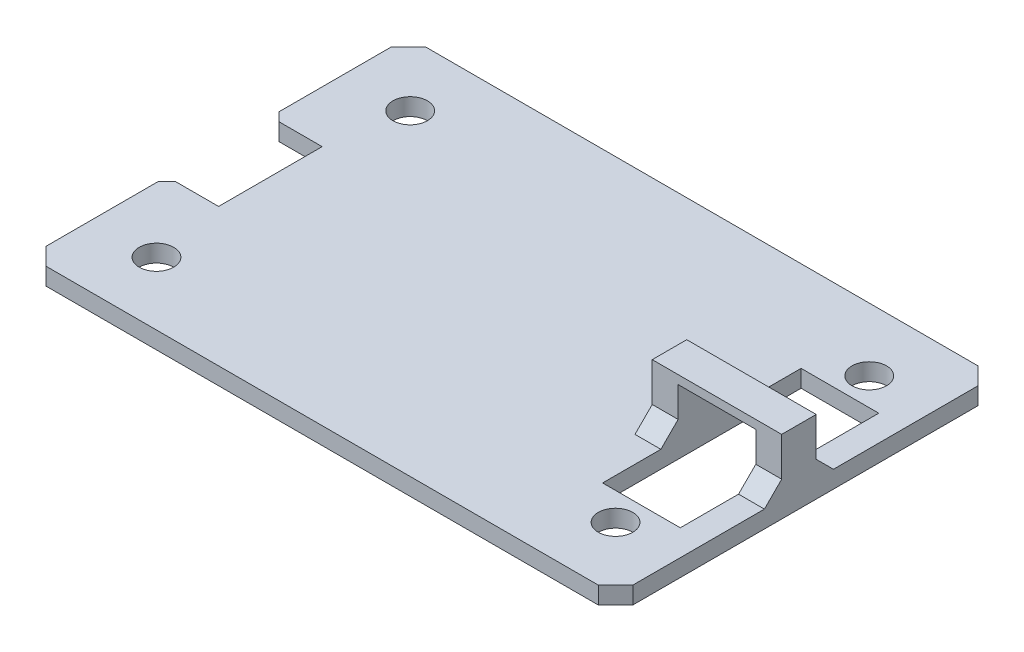
from build123d import *

# Parameters (mm, degrees)
SKETCH1_W               = 68
SKETCH1_H               = 44
BOSS_EXTRUDE1_DEPTH     = 2
SKETCH2_R               = 2
CUT_EXTRUDE1_DEPTH      = 2
SKETCH3_W               = 12
SKETCH3_H               = 23
CUT_EXTRUDE2_DEPTH      = 2
SKETCH4_W               = 3
SKETCH4_H               = 23
BOSS_EXTRUDE2_DEPTH     = 2
SKETCH5_W               = 3
SKETCH5_H               = 21.5
BOSS_EXTRUDE3_DEPTH     = 6.5
SKETCH6_W               = 4
SKETCH6_H               = 2
BOSS_EXTRUDE4_DEPTH     = 10
CUT_EXTRUDE3_DEPTH      = 20
CUT_EXTRUDE3_DEPTH_BACK = 20
SKETCH7_W               = 8.75
SKETCH7_H               = 6.5
SKETCH7_W_2             = 10.25
CHAMFER1_SIZE           = 2
SKETCH8_W               = 6
SKETCH8_H               = 12
CUT_EXTRUDE4_DEPTH      = 20
CHAMFER2_SIZE           = 1
CHAMFER3_SIZE           = 1
CHAMFER4_SIZE           = 2


with BuildPart() as part:
    # Sketch1 → Boss-Extrude1 (new body)
    with BuildSketch(Plane(origin=(0, 0, 0), x_dir=(1, 0, 0), z_dir=(0, 1, 0))):
        with Locations((4.391941392, -7.446886447)):
            Rectangle(SKETCH1_W, SKETCH1_H)
    extrude(amount=BOSS_EXTRUDE1_DEPTH)

    # Sketch2 → Cut-Extrude1 (cut)
    with BuildSketch(Plane(origin=(0, 2, 0), x_dir=(1, 0, 0), z_dir=(0, 1, 0))):
        with Locations(Location((-22.108058608, 7.253113553, 0), (0, 0, 270))):
            Circle(SKETCH2_R)
        with Locations(Location((31.091941392, 7.253113553, 0), (0, 0, 270))):
            Circle(SKETCH2_R)
        with Locations(Location((31.091941392, -22.146886447, 0), (0, 0, 270))):
            Circle(SKETCH2_R)
        with Locations(Location((-22.108058608, -22.146886447, 0), (0, 0, 270))):
            Circle(SKETCH2_R)
    extrude(amount=-CUT_EXTRUDE1_DEPTH, mode=Mode.SUBTRACT)

    # Sketch3 → Cut-Extrude2 (cut)
    with BuildSketch(Plane(origin=(0, 2, 0), x_dir=(1, 0, 0), z_dir=(0, 1, 0))):
        with Locations((32.391941392, -7.446886447)):
            Rectangle(SKETCH3_W, SKETCH3_H)
    extrude(amount=-CUT_EXTRUDE2_DEPTH, mode=Mode.SUBTRACT)

    # Sketch4 → Boss-Extrude2 (add)
    with BuildSketch(Plane(origin=(0, 2, 0), x_dir=(1, 0, 0), z_dir=(0, 1, 0))):
        with Locations((36.891941392, -7.446886447)):
            Rectangle(SKETCH4_W, SKETCH4_H)
    extrude(amount=-BOSS_EXTRUDE2_DEPTH)

    # Sketch5 → Boss-Extrude3 (add)
    with BuildSketch(Plane(origin=(0, 2, 0), x_dir=(1, 0, 0), z_dir=(0, 1, 0))):
        with Locations((36.891941392, -6.696886447)):
            Rectangle(SKETCH5_W, SKETCH5_H)
        with Locations((24.891941392, -8.196886447)):
            Rectangle(SKETCH5_W, SKETCH5_H)
    extrude(amount=BOSS_EXTRUDE3_DEPTH)

    # Sketch6 → Boss-Extrude4 (add)
    with BuildSketch(Plane(origin=(26.391941392, 0, 0), x_dir=(0, 0, -1), z_dir=(1, 0, 0))):
        with Locations((-8.196886447, 7.5)):
            Rectangle(SKETCH6_W, SKETCH6_H)
    extrude(amount=BOSS_EXTRUDE4_DEPTH)

    # Sketch7 → Cut-Extrude3 (cut, two sides: drawn at the far end of the back side and taken through both)
    with BuildSketch(Plane(origin=(26.391941392, 0, 0), x_dir=(0, 0, -1), z_dir=(1, 0, 0)).offset(-CUT_EXTRUDE3_DEPTH_BACK)):
        with Locations((-14.571886447, 5.25)):
            Rectangle(SKETCH7_W, SKETCH7_H)
        with Locations((-1.071886447, 5.25)):
            Rectangle(SKETCH7_W_2, SKETCH7_H)
    extrude(amount=CUT_EXTRUDE3_DEPTH + CUT_EXTRUDE3_DEPTH_BACK, mode=Mode.SUBTRACT)

    # Chamfer1
    chamfer1_edges = [part.edges().sort_by_distance(p)[0] for p in [
        (24.891941392, 2, 10.196886447),
        (36.891941392, 2, 10.196886447),
        (24.891941392, 2, 6.196886447),
        (36.891941392, 2, 6.196886447),
    ]]
    chamfer(chamfer1_edges, length=CHAMFER1_SIZE)

    # Sketch8 → Cut-Extrude4 (cut)
    with BuildSketch(Plane(origin=(0, 2, 0), x_dir=(1, 0, 0), z_dir=(0, 1, 0))):
        with Locations((-26.608058608, -7.446886447)):
            Rectangle(SKETCH8_W, SKETCH8_H)
    extrude(amount=-CUT_EXTRUDE4_DEPTH, mode=Mode.SUBTRACT)

    # Chamfer2
    chamfer2_edges = [part.edges().sort_by_distance(p)[0] for p in [
        (-29.608058608, 1, 13.446886447),
        (-29.608058608, 1, 1.446886447),
    ]]
    chamfer(chamfer2_edges, length=CHAMFER2_SIZE)

    # Chamfer3
    chamfer3_edges = [part.edges().sort_by_distance(p)[0] for p in [
        (30.891941392, 6.5, 10.196886447),
    ]]
    chamfer(chamfer3_edges, length=CHAMFER3_SIZE)

    # Chamfer4
    chamfer4_edges = [part.edges().sort_by_distance(p)[0] for p in [
        (-29.608058608, 1, -14.553113553),
        (38.391941392, 1, -14.553113553),
        (38.391941392, 1, 29.446886447),
        (-29.608058608, 1, 29.446886447),
    ]]
    chamfer(chamfer4_edges, length=CHAMFER4_SIZE)


solid = part.part
